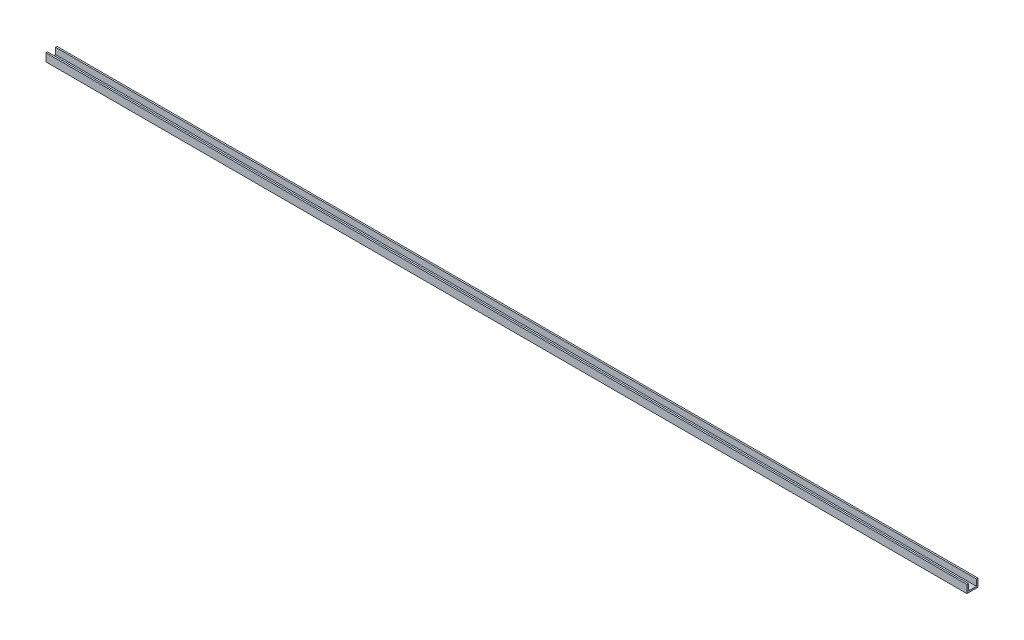
from build123d import *

# Parameters (mm, degrees)
BOSS_EXTRUDE1_DEPTH = 580


with BuildPart() as part:
    # Sketch1 → Boss-Extrude1 (new body)
    with BuildSketch(Plane(origin=(0, 0, 0), x_dir=(0, 0, -1), z_dir=(1, 0, 0))):
        Polygon((-3.5, 0), (3.5, 0), (3.5, 5), (2.5, 5), (2.5, 1), (-2.5, 1), (-2.5, 5), (-3.5, 5), align=None)
    extrude(amount=BOSS_EXTRUDE1_DEPTH)


solid = part.part
